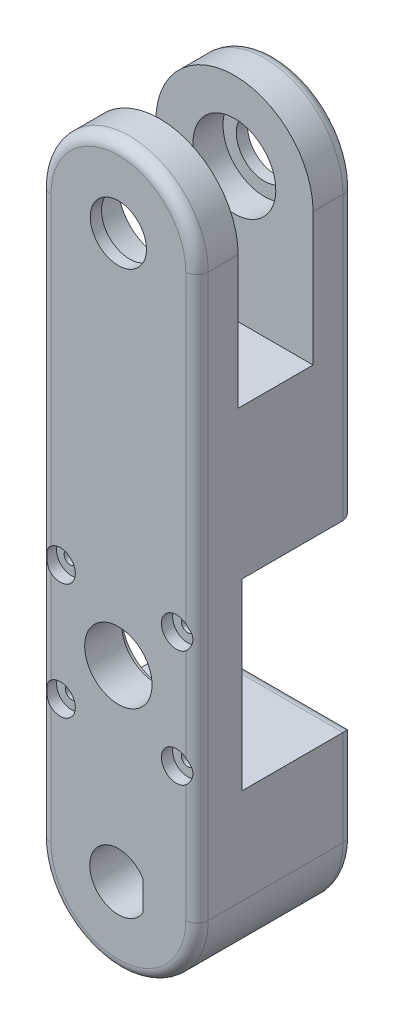
from build123d import *

# Parameters (mm, degrees)
EXTRUDE_1_DEPTH          = 42
SKETCH_2_R               = 9
CUT_EXTRUDE_1_DEPTH      = 178.330200474
SKETCH_3_W               = 50
SKETCH_3_H               = 49
CUT_EXTRUDE_2_DEPTH      = 30
SKETCH_4_W               = 20
SKETCH_4_H               = 71
CUT_EXTRUDE_3_DEPTH      = 182.022098099
CUT_EXTRUDE_START        = -3
SKETCH_5_R               = 11.05
CUT_EXTRUDE_4_DEPTH      = 10
FILLET_1_R               = 3
FILLET_2_R               = 3
SKETCH_6_R               = 7.5
CUT_EXTRUDE_5_DEPTH      = 10
SKETCH_8_R               = 1.65
CUT_EXTRUDE_6_DEPTH      = 175.877099799
SKETCH_9_R               = 4
CUT_EXTRUDE_7_DEPTH      = 3
CUT_EXTRUDE_8_DEPTH      = 178.330200582
CUT_EXTRUDE_8_DEPTH_BACK = 178.330200582
SKETCH_14_R              = 15.1
CUT_EXTRUDE_9_DEPTH      = 10
SKETCH_15_R              = 11.1
CUT_EXTRUDE_10_DEPTH     = 2.1


with BuildPart() as part:
    # 草图1 → 凸台-拉伸1 (new body)
    with BuildSketch(Plane.XY):
        with BuildLine():
            Line((-21, 0), (-21, 150))
            ThreePointArc((-21, 150), (0, 171), (21, 150))
            Line((21, 150), (21, 0))
            ThreePointArc((21, 0), (0, -21), (-21, 0))
        make_face()
    extrude(amount=EXTRUDE_1_DEPTH)

    # 草图2 → 切除-拉伸1 (cut, through all)
    with BuildSketch(Plane(origin=(0, 0, 0), x_dir=(-1, 0, 0), z_dir=(0, 0, -1))):
        with Locations((0, 50)):
            Circle(SKETCH_2_R)
    extrude(amount=-CUT_EXTRUDE_1_DEPTH, mode=Mode.SUBTRACT)

    # 草图3 → 切除-拉伸2 (cut)
    with BuildSketch(Plane(origin=(0, 0, 0), x_dir=(-1, 0, 0), z_dir=(0, 0, -1))):
        with Locations((0, 50)):
            Rectangle(SKETCH_3_W, SKETCH_3_H)
    extrude(amount=-CUT_EXTRUDE_2_DEPTH, mode=Mode.SUBTRACT)

    # 草图4 → 切除-拉伸3 (cut, through all)
    with BuildSketch(Plane.ZY.offset(21)):
        with Locations((21, 150)):
            Rectangle(SKETCH_4_W, SKETCH_4_H)
    extrude(amount=-CUT_EXTRUDE_3_DEPTH, mode=Mode.SUBTRACT)

    # 草图5 → 切除-拉伸4 (cut)
    with BuildSketch(Plane.XY.offset(42).offset(CUT_EXTRUDE_START)):
        with Locations((0, 150)):
            Circle(SKETCH_5_R)
    cut_extrude_4 = extrude(amount=-CUT_EXTRUDE_4_DEPTH, mode=Mode.SUBTRACT)

    # 圆角1
    fillet_1_edges = [part.edges().sort_by_distance(p)[0] for p in [
        (0, 171, 42),
        (-21, 75, 42),
        (0, -21, 42),
        (21, 75, 42),
    ]]
    fillet(fillet_1_edges, radius=FILLET_1_R)

    # 圆角2
    fillet_2_edges = [part.edges().sort_by_distance(p)[0] for p in [
        (-21, 12.75, 0),
        (21, 112.25, 0),
        (0, 25.5, 0),
        (0, 74.5, 0),
        (-21, 112.25, 0),
        (0, 171, 0),
        (21, 12.75, 0),
        (0, -21, 0),
    ]]
    fillet(fillet_2_edges, radius=FILLET_2_R)

    # 草图6 → 切除-拉伸5 (cut)
    with BuildSketch(Plane(origin=(0, 0, 39), x_dir=(-1, 0, 0), z_dir=(0, 0, -1))):
        with Locations((0, 150)):
            Circle(SKETCH_6_R)
    cut_extrude_5 = extrude(amount=-CUT_EXTRUDE_5_DEPTH, mode=Mode.SUBTRACT)

    # 镜向1: 切除-拉伸4, 切除-拉伸5 across plane
    add(cut_extrude_4.mirror(Plane.XY.offset(21)), mode=Mode.SUBTRACT)
    add(cut_extrude_5.mirror(Plane.XY.offset(21)), mode=Mode.SUBTRACT)

    # 草图8 → 切除-拉伸6 (cut, through all)
    with BuildSketch(Plane(origin=(0, 0, 30), x_dir=(-1, 0, 0), z_dir=(0, 0, -1))):
        with Locations((-15.5, 34.5)):
            Circle(SKETCH_8_R)
        with Locations((-15.5, 65.5)):
            Circle(SKETCH_8_R)
        with Locations((15.833547664, 65.5)):
            Circle(SKETCH_8_R)
        with Locations((15.5, 34.5)):
            Circle(SKETCH_8_R)
    extrude(amount=-CUT_EXTRUDE_6_DEPTH, mode=Mode.SUBTRACT)

    # 草图9 → 切除-拉伸7 (cut)
    with BuildSketch(Plane.XY.offset(42)):
        with Locations((15.5, 65.5)):
            Circle(SKETCH_9_R)
        with Locations((15.5, 34.5)):
            Circle(SKETCH_9_R)
        with Locations((-15.5, 65.5)):
            Circle(SKETCH_9_R)
        with Locations((-15.5, 34.5)):
            Circle(SKETCH_9_R)
    extrude(amount=-CUT_EXTRUDE_7_DEPTH, mode=Mode.SUBTRACT)

    # 草图13 → 切除-拉伸8 (cut, two sides: drawn at the far end of the back side and taken through both)
    with BuildSketch(Plane.XY.offset(42).offset(-CUT_EXTRUDE_8_DEPTH_BACK)):
        with BuildLine():
            ThreePointArc((6.6, 3.868139087), (3.803369295, 6.637535839), (0, 7.65))
            Line((0, 7.65), (0, -7.65))
            ThreePointArc((0, -7.65), (3.803369295, -6.637535839), (6.6, -3.868139087))
            Line((6.6, -3.868139087), (6.6, 3.868139087))
        make_face()
        with BuildLine():
            Line((0, -7.65), (0, 7.65))
            ThreePointArc((0, 7.65), (-7.65, 0), (0, -7.65))
        make_face()
    extrude(amount=CUT_EXTRUDE_8_DEPTH + CUT_EXTRUDE_8_DEPTH_BACK, mode=Mode.SUBTRACT)

    # 草图14 → 切除-拉伸9 (cut)
    with BuildSketch(Plane(origin=(0, 0, 0), x_dir=(-1, 0, 0), z_dir=(0, 0, -1))):
        Circle(SKETCH_14_R)
    extrude(amount=-CUT_EXTRUDE_9_DEPTH, mode=Mode.SUBTRACT)

    # 草图15 → 切除-拉伸10 (cut)
    with BuildSketch(Plane(origin=(0, 0, 30), x_dir=(-1, 0, 0), z_dir=(0, 0, -1))):
        with Locations((0, 50)):
            Circle(SKETCH_15_R)
    extrude(amount=-CUT_EXTRUDE_10_DEPTH, mode=Mode.SUBTRACT)


solid = part.part
